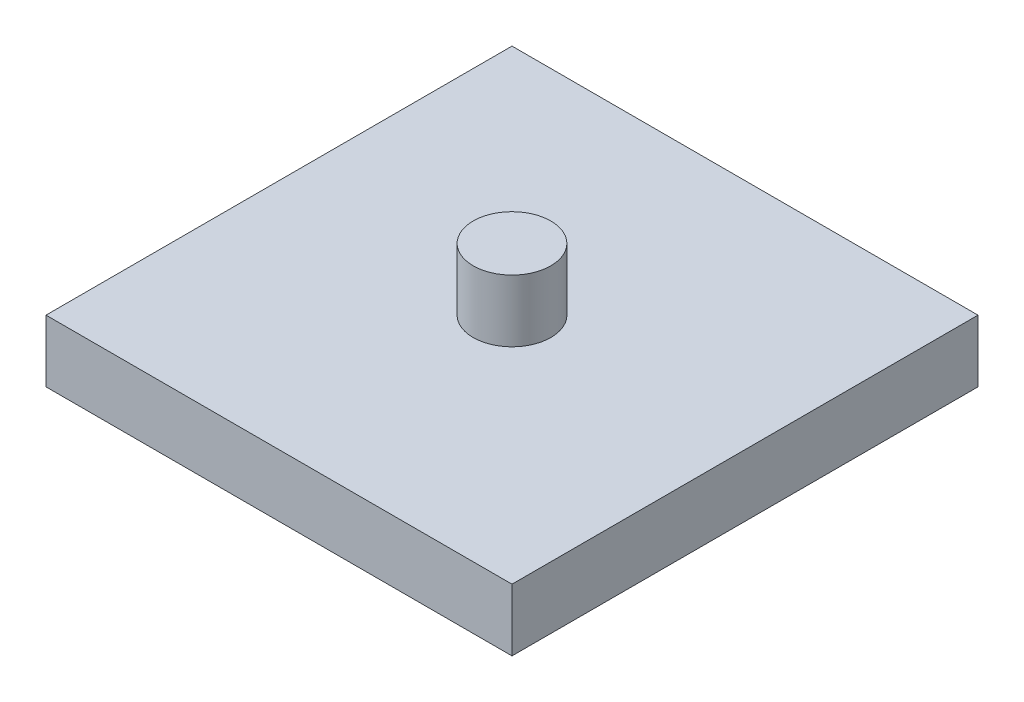
from build123d import *

# Parameters (mm, degrees)
SKETCH2_W           = 300
SKETCH2_H           = 300
BOSS_EXTRUDE1_DEPTH = 40
SKETCH3_R           = 25
BOSS_EXTRUDE2_DEPTH = 40


with BuildPart() as part:
    # Sketch2 → Boss-Extrude1 (new body)
    with BuildSketch(Plane(origin=(0, 0, 0), x_dir=(1, 0, 0), z_dir=(0, 1, 0))):
        Rectangle(SKETCH2_W, SKETCH2_H)
    extrude(amount=BOSS_EXTRUDE1_DEPTH)

    # Sketch3 → Boss-Extrude2 (add)
    with BuildSketch(Plane(origin=(0, 40, 0), x_dir=(1, 0, 0), z_dir=(0, 1, 0))):
        with Locations(Location((0, 0, 0), (0, 0, 270))):
            Circle(SKETCH3_R)
    extrude(amount=BOSS_EXTRUDE2_DEPTH)


solid = part.part
